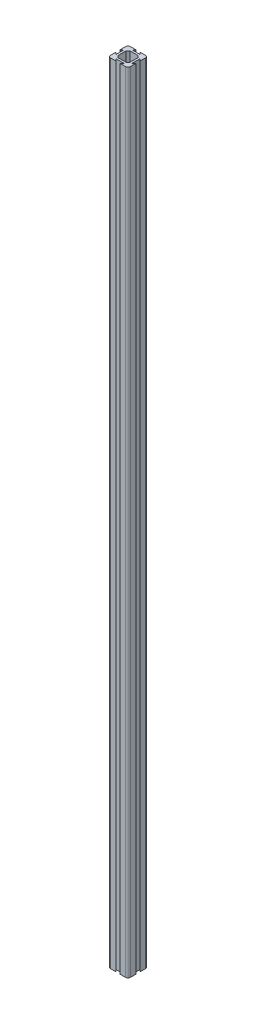
from build123d import *

# Parameters (mm, degrees)
BOSS_EXTRUDE1_DEPTH = 1000


with BuildPart() as part:
    # Sketch1 → Boss-Extrude1 (new body)
    with BuildSketch(Plane(origin=(0, 0, 0), x_dir=(1, 0, 0), z_dir=(0, 1, 0))):
        with BuildLine():
            Line((-9.5, 12.5), (-2.5, 12.5))
            Line((-2.5, 12.5), (-5, 10))
            Line((-5, 10), (5, 10))
            Line((5, 10), (2.5, 12.5))
            Line((2.5, 12.5), (9.5, 12.5))
            ThreePointArc((9.5, 12.5), (11.621320344, 11.621320344), (12.5, 9.5))
            Line((12.5, 9.5), (12.5, 2.5))
            Line((12.5, 2.5), (10, 5))
            Line((10, 5), (10, -5))
            Line((10, -5), (12.5, -2.5))
            Line((12.5, -2.5), (12.5, -9.5))
            ThreePointArc((12.5, -9.5), (11.621320344, -11.621320344), (9.5, -12.5))
            Line((9.5, -12.5), (2.5, -12.5))
            Line((2.5, -12.5), (5, -10))
            Line((5, -10), (-5, -10))
            Line((-5, -10), (-2.5, -12.5))
            Line((-2.5, -12.5), (-9.5, -12.5))
            ThreePointArc((-9.5, -12.5), (-11.621320344, -11.621320344), (-12.5, -9.5))
            Line((-12.5, -9.5), (-12.5, -2.5))
            Line((-12.5, -2.5), (-10, -5))
            Line((-10, -5), (-10, 5))
            Line((-10, 5), (-12.5, 2.5))
            Line((-12.5, 2.5), (-12.5, 9.5))
            ThreePointArc((-12.5, 9.5), (-11.621320344, 11.621320344), (-9.5, 12.5))
        make_face()
        Polygon((-7.5, 5), (-5, 7.5), (5, 7.5), (7.5, 5), (7.5, -5), (5, -7.5), (-5, -7.5), (-7.5, -5), align=None, mode=Mode.SUBTRACT)
    extrude(amount=BOSS_EXTRUDE1_DEPTH)


solid = part.part
